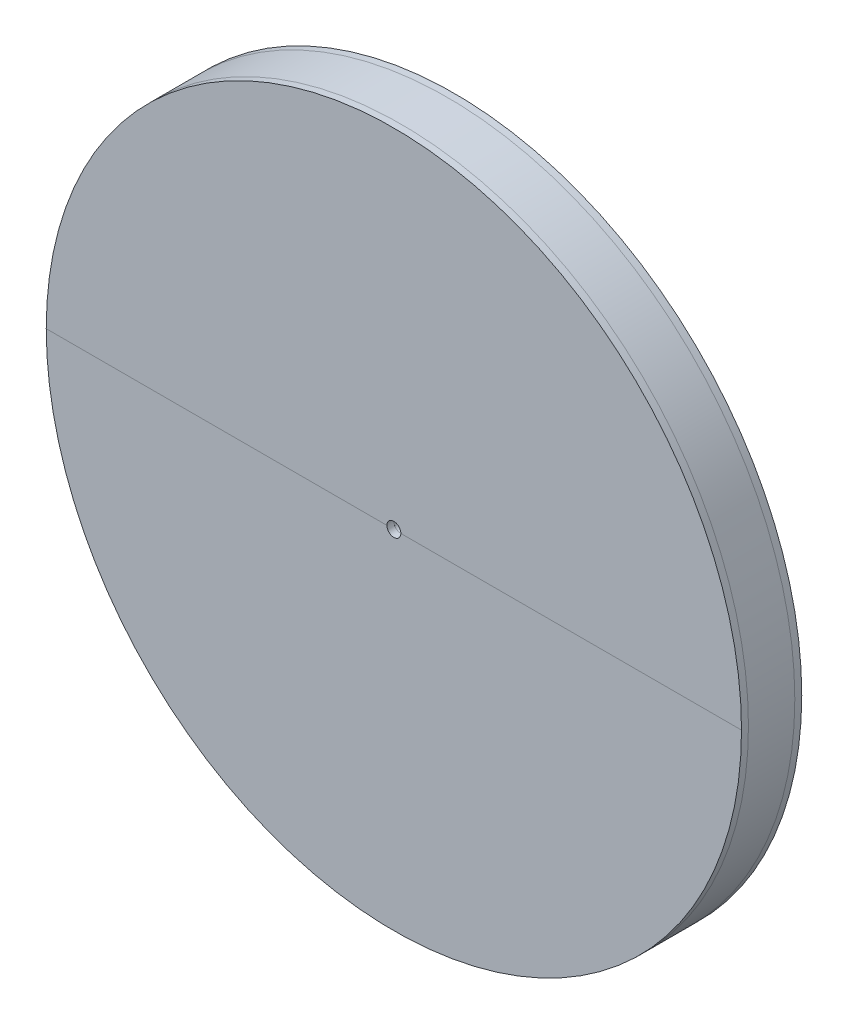
from build123d import *

# Parameters (mm, degrees)
ESQUISSE1_R        = 150
ESQUISSE1_R_2      = 3
BOSS_EXTRU_1_DEPTH = 10
ESQUISSE2_R        = 150
ESQUISSE2_R_2      = 3
BOSS_EXTRU_2_DEPTH = 3


with BuildPart() as part:
    # Esquisse1 → Boss.-Extru.1 (new, symmetric)
    with BuildSketch(Plane.XY):
        Circle(ESQUISSE1_R)
        Circle(ESQUISSE1_R_2, mode=Mode.SUBTRACT)
        with BuildLine():
            Line((-25, 137.74977314), (-25, -137.74977314))
            ThreePointArc((-25, -137.74977314), (-140, 0), (-25, 137.74977314))
        make_face(mode=Mode.SUBTRACT)
        with BuildLine():
            Line((-15, 139.194109071), (-15, 20))
            Line((-15, 20), (15, 20))
            Line((15, 20), (15, 139.194109071))
            ThreePointArc((15, 139.194109071), (0, 140), (-15, 139.194109071))
        make_face(mode=Mode.SUBTRACT)
        with BuildLine():
            Line((-15, -20), (15, -20))
            Line((15, -20), (15, -139.194109071))
            ThreePointArc((15, -139.194109071), (0, -140), (-15, -139.194109071))
            Line((-15, -139.194109071), (-15, -20))
        make_face(mode=Mode.SUBTRACT)
        with BuildLine():
            Line((25, 137.74977314), (25, -137.74977314))
            ThreePointArc((25, -137.74977314), (140, 0), (25, 137.74977314))
        make_face(mode=Mode.SUBTRACT)
    extrude(amount=BOSS_EXTRU_1_DEPTH, both=True)


with BuildPart() as body_2:
    # Esquisse2 → Boss.-Extru.2 (new body)
    with BuildSketch(Plane(origin=(0, 0, -10), x_dir=(-1, 0, 0), z_dir=(0, 0, -1))):
        Circle(ESQUISSE2_R)
        Circle(ESQUISSE2_R_2, mode=Mode.SUBTRACT)
    extrude(amount=BOSS_EXTRU_2_DEPTH)


with BuildPart() as body_3:
    # Symétrie1: mirrored copy
    add(body_2.part.mirror(Plane.XY))


solid = Compound([part.part, body_2.part, body_3.part])
